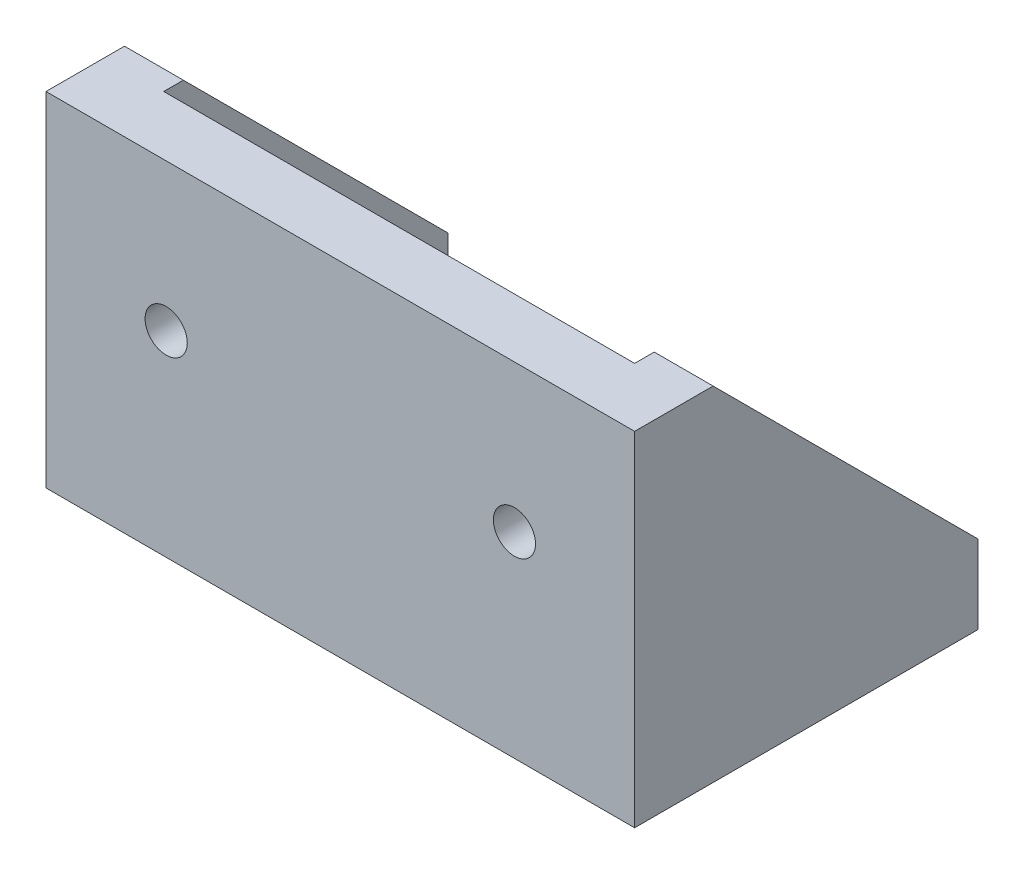
from build123d import *

# Parameters (mm, degrees)
BOSS_EXTRUDE1_DEPTH = 30
SKETCH5_W           = 48
SKETCH5_H           = 29
CUT_EXTRUDE1_DEPTH  = 29
SKETCH4_R           = 2.15
CUT_EXTRUDE2_DEPTH  = 58.879184514
SKETCH6_R           = 3.5
CUT_EXTRUDE3_DEPTH  = 55.460995217


with BuildPart() as part:
    # Sketch2 → Boss-Extrude1 (new, symmetric)
    with BuildSketch(Plane(origin=(0, 0, 0), x_dir=(0, 0, -1), z_dir=(1, 0, 0))):
        Polygon((0, 0), (35, 0), (35, 8), (8, 35), (0, 35), align=None)
    extrude(amount=BOSS_EXTRUDE1_DEPTH, both=True)

    # Sketch5 → Cut-Extrude1 (cut)
    with BuildSketch(Plane(origin=(0, 0, -35), x_dir=(-1, 0, 0), z_dir=(0, 0, -1))):
        with Locations((0, 20.5)):
            Rectangle(SKETCH5_W, SKETCH5_H)
    extrude(amount=-CUT_EXTRUDE1_DEPTH, mode=Mode.SUBTRACT)

    # Sketch4 → Cut-Extrude2 (cut, through all)
    with BuildSketch(Plane.XY):
        with Locations((-17.75, 20)):
            Circle(SKETCH4_R)
        with Locations((17.75, 20)):
            Circle(SKETCH4_R)
    extrude(amount=-CUT_EXTRUDE2_DEPTH, mode=Mode.SUBTRACT)

    # Sketch6 → Cut-Extrude3 (cut, through all)
    with BuildSketch(Plane(origin=(0, 6, 0), x_dir=(1, 0, 0), z_dir=(0, 1, 0))):
        with Locations(Location((0, 11, 0), (0, 0, 270))):
            Circle(SKETCH6_R)
        with Locations(Location((0, 29, 0), (0, 0, 90))):
            Circle(SKETCH6_R)
    extrude(amount=-CUT_EXTRUDE3_DEPTH, mode=Mode.SUBTRACT)


solid = part.part
